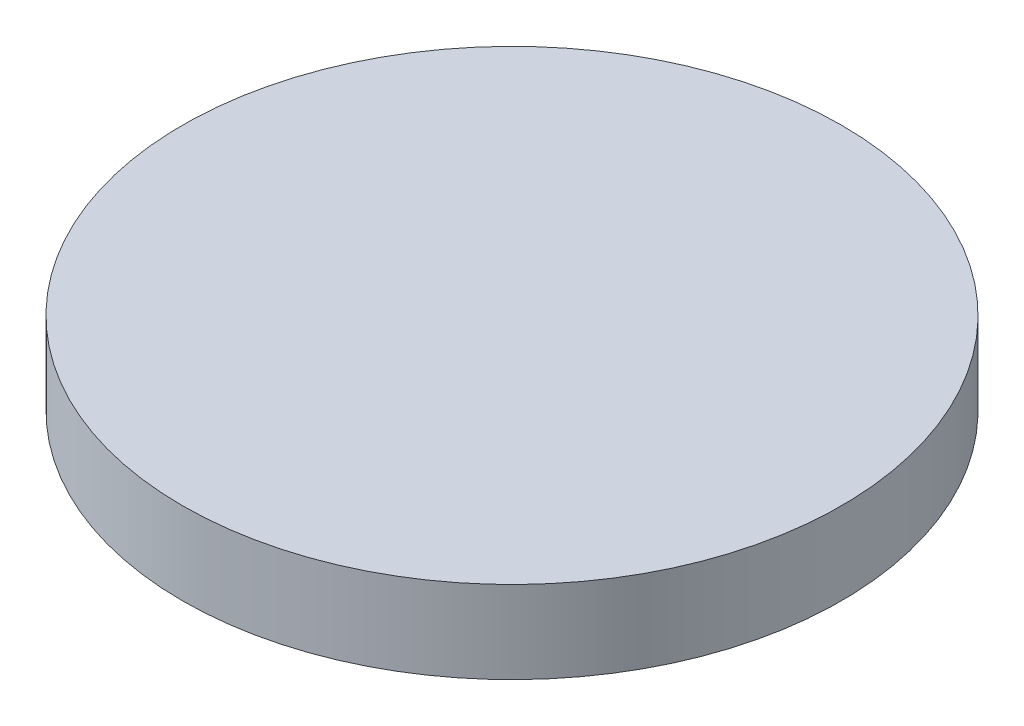
from build123d import *

# Parameters (mm, degrees)
SKETCH3_R           = 50.8
BOSS_EXTRUDE1_DEPTH = 12.7


with BuildPart() as part:
    # Sketch3 → Boss-Extrude1 (new body)
    with BuildSketch(Plane(origin=(0, 0, 0), x_dir=(1, 0, 0), z_dir=(0, 1, 0))):
        with Locations(Location((0, 0, 0), (0, 0, 270))):
            Circle(SKETCH3_R)
    extrude(amount=BOSS_EXTRUDE1_DEPTH)


solid = part.part
